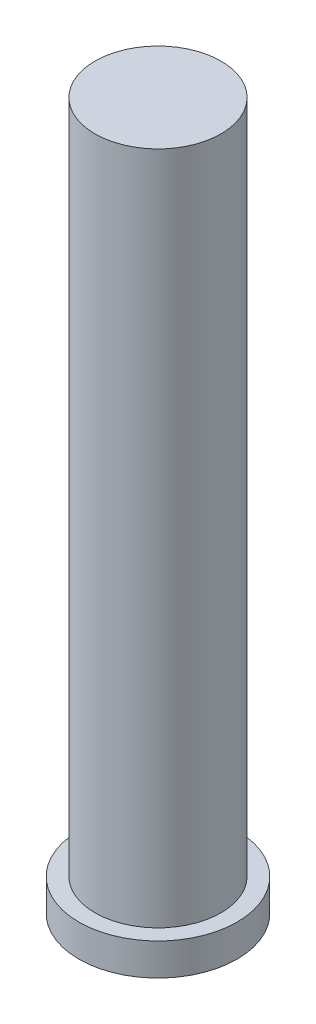
from build123d import *

# Parameters (mm, degrees)
SKIZZE1_R                       = 4.925
AUFSATZ_LINEAR_AUSTRAGEN1_DEPTH = 2
SKIZZE2_R                       = 3.925
AUFSATZ_LINEAR_AUSTRAGEN2_DEPTH = 42


with BuildPart() as part:
    # Skizze1 → Aufsatz-Linear austragen1 (new body)
    with BuildSketch(Plane(origin=(0, 0, 0), x_dir=(1, 0, 0), z_dir=(0, 1, 0))):
        with Locations(Location((0, 0, 0), (0, 0, 270))):
            Circle(SKIZZE1_R)
    extrude(amount=AUFSATZ_LINEAR_AUSTRAGEN1_DEPTH)

    # Skizze2 → Aufsatz-Linear austragen2 (add)
    with BuildSketch(Plane(origin=(0, 2, 0), x_dir=(1, 0, 0), z_dir=(0, 1, 0))):
        with Locations(Location((0, 0, 0), (0, 0, 270))):
            Circle(SKIZZE2_R)
    extrude(amount=AUFSATZ_LINEAR_AUSTRAGEN2_DEPTH)


solid = part.part
